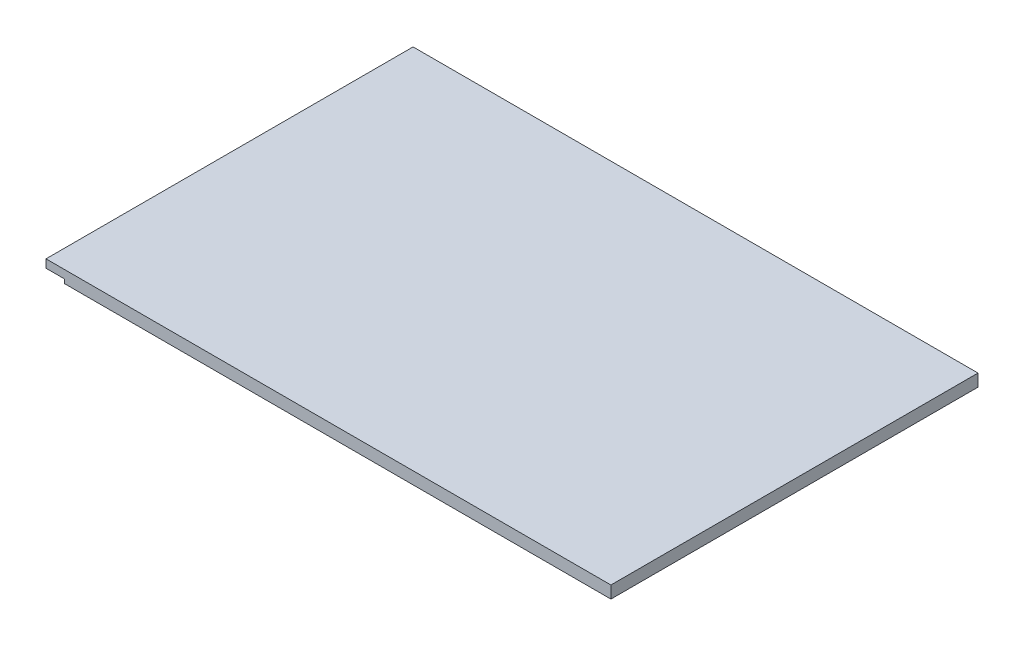
from build123d import *

# Parameters (mm, degrees)
SKETCH1_W           = 670
SKETCH1_H           = 450
BOSS_EXTRUDE1_DEPTH = 7.5
SKETCH2_R           = 2.5
CUT_EXTRUDE1_DEPTH  = 10
SKETCH3_W           = 22.5
SKETCH3_H           = 450
BOSS_EXTRUDE2_DEPTH = 10
SKETCH4_R           = 2.5
CUT_EXTRUDE2_DEPTH  = 10


with BuildPart() as part:
    # Sketch1 → Boss-Extrude1 (new, symmetric)
    with BuildSketch(Plane(origin=(0, 0, 0), x_dir=(1, 0, 0), z_dir=(0, 1, 0))):
        Rectangle(SKETCH1_W, SKETCH1_H)
    extrude(amount=BOSS_EXTRUDE1_DEPTH, both=True)

    # Sketch2 → Cut-Extrude1 (cut)
    with BuildSketch(Plane.XZ.offset(7.5)):
        with Locations(Location((-328, -150, 0), (0, 0, 270))):
            Circle(SKETCH2_R)
        with Locations(Location((-328, -110, 0), (0, 0, 270))):
            Circle(SKETCH2_R)
        with Locations(Location((-313, -130, 0), (0, 0, 270))):
            Circle(SKETCH2_R)
        with Locations(Location((-328, 150, 0), (0, 0, 90))):
            Circle(SKETCH2_R)
        with Locations(Location((-313, 130, 0), (0, 0, 90))):
            Circle(SKETCH2_R)
        with Locations(Location((-328, 110, 0), (0, 0, 90))):
            Circle(SKETCH2_R)
        with Locations(Location((328, 150, 0), (0, 0, 270))):
            Circle(SKETCH2_R)
        with Locations(Location((328, 110, 0), (0, 0, 270))):
            Circle(SKETCH2_R)
        with Locations(Location((313, 130, 0), (0, 0, 270))):
            Circle(SKETCH2_R)
        with Locations(Location((328, -150, 0), (0, 0, 90))):
            Circle(SKETCH2_R)
        with Locations(Location((313, -130, 0), (0, 0, 90))):
            Circle(SKETCH2_R)
        with Locations(Location((328, -110, 0), (0, 0, 90))):
            Circle(SKETCH2_R)
    extrude(amount=-CUT_EXTRUDE1_DEPTH, mode=Mode.SUBTRACT)

    # Sketch3 → Boss-Extrude2 (add)
    with BuildSketch(Plane(origin=(0, 7.5, 0), x_dir=(1, 0, 0), z_dir=(0, 1, 0))):
        with Locations((-346.25, 0)):
            Rectangle(SKETCH3_W, SKETCH3_H)
    extrude(amount=-BOSS_EXTRUDE2_DEPTH)

    # Sketch4 → Cut-Extrude2 (cut)
    with BuildSketch(Plane(origin=(0, -7.5, 0), x_dir=(-1, 0, 0), z_dir=(0, -1, 0))):
        with Locations(Location((313, 0, 0), (0, 0, 90))):
            Circle(SKETCH4_R)
        with Locations(Location((328, -20, 0), (0, 0, 90))):
            Circle(SKETCH4_R)
        with Locations(Location((328, 20, 0), (0, 0, 90))):
            Circle(SKETCH4_R)
    extrude(amount=-CUT_EXTRUDE2_DEPTH, mode=Mode.SUBTRACT)


solid = part.part
